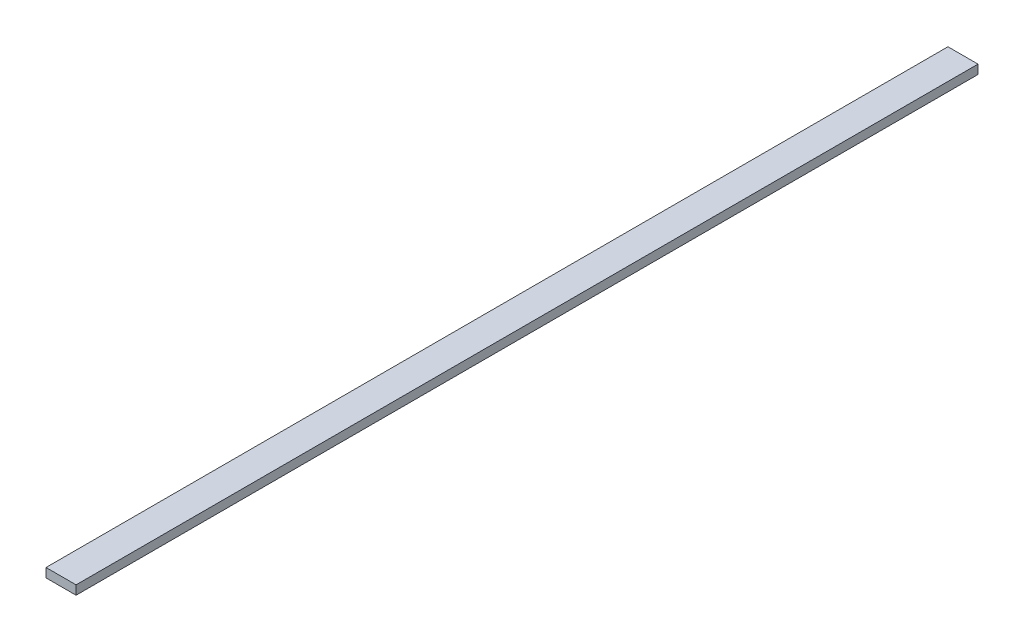
from build123d import *

# Parameters (mm, degrees)
SKETCH_1_W      = 10
SKETCH_1_H      = 300
EXTRUDE_1_DEPTH = 3


with BuildPart() as part:
    # 草图1 → 凸台-拉伸1 (new body)
    with BuildSketch(Plane(origin=(0, 0, 0), x_dir=(1, 0, 0), z_dir=(0, 1, 0))):
        with Locations((-18.653784197, -102.300379935)):
            Rectangle(SKETCH_1_W, SKETCH_1_H)
    extrude(amount=EXTRUDE_1_DEPTH)


solid = part.part
